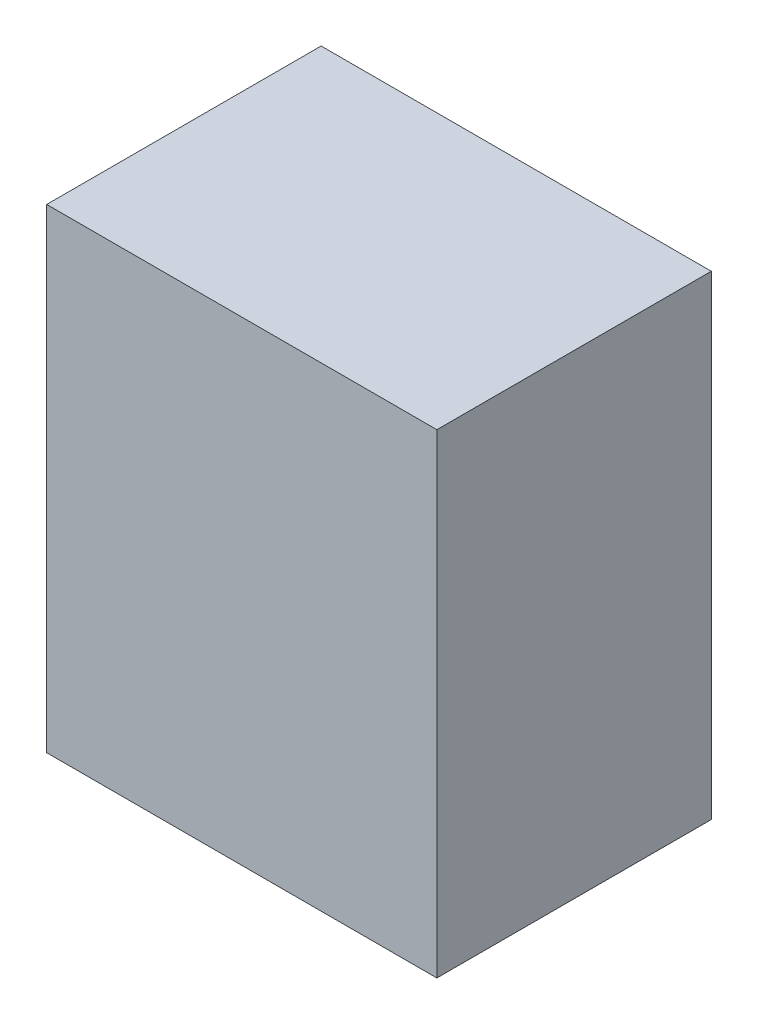
from build123d import *

# Parameters (mm, degrees)
CROQUIS1_W              = 189.790874951
CROQUIS1_H              = 133.496971364
SALIENTE_EXTRUIR1_DEPTH = 231


with BuildPart() as part:
    # Croquis1 → Saliente-Extruir1 (new body)
    with BuildSketch(Plane(origin=(0, 0, 0), x_dir=(1, 0, 0), z_dir=(0, 1, 0))):
        with Locations((-60.314896701, 29.152200072)):
            Rectangle(CROQUIS1_W, CROQUIS1_H)
    extrude(amount=SALIENTE_EXTRUIR1_DEPTH)


solid = part.part
